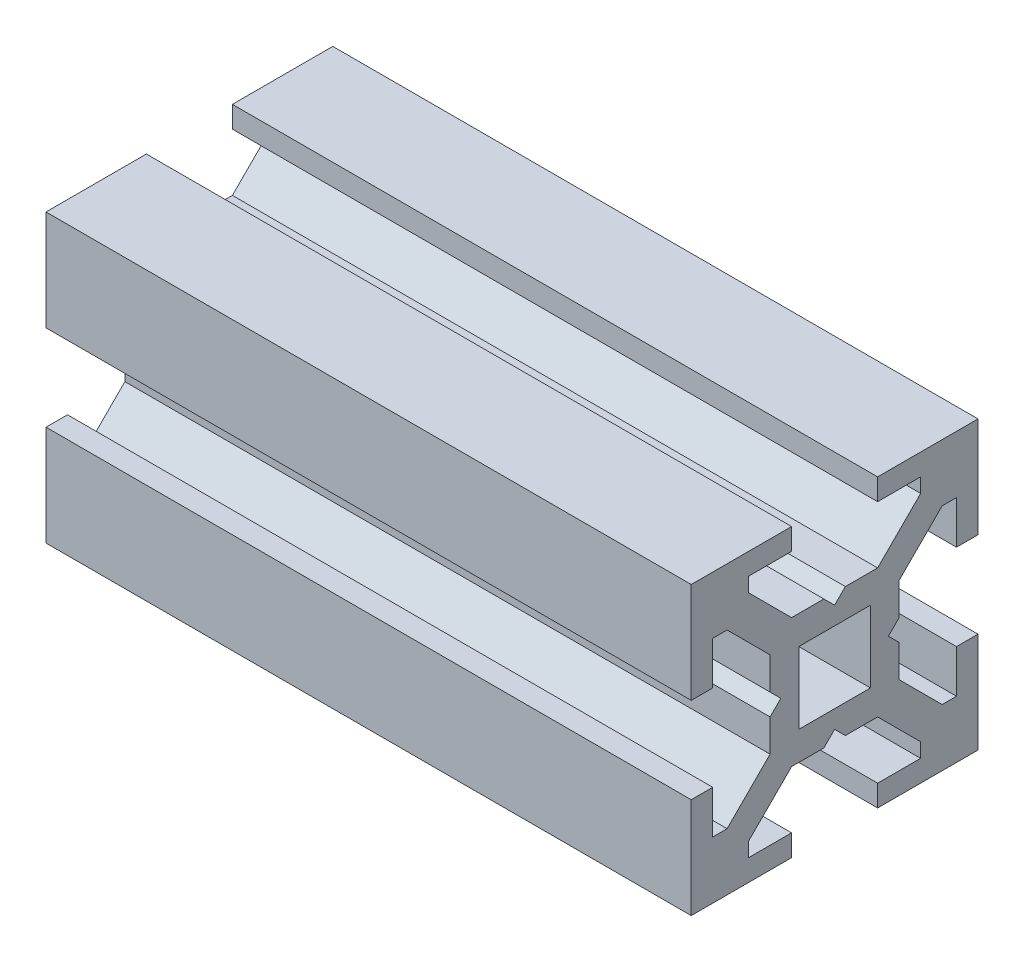
from build123d import *

# Parameters (mm, degrees)
SKETCH1_W           = 5
SKETCH1_H           = 5
BOSS_EXTRUDE2_DEPTH = 45


with BuildPart() as part:
    # Sketch1 → Boss-Extrude2 (new body)
    with BuildSketch(Plane(origin=(0, 0, 0), x_dir=(0, 0, -1), z_dir=(1, 0, 0))):
        Polygon((-10, 10), (-3, 10), (-3, 8.5), (-6, 8.5), (-6, 7.5), (-3, 4.5), (-0.75, 4.5), (0, 3.75), (0.75, 4.5), (3, 4.5), (6, 7.5), (6, 8.5), (3, 8.5), (3, 10), (10, 10), (10, 3), (8.5, 3), (8.5, 6), (7.5, 6), (4.5, 3), (4.5, 0.75), (3.75, 0), (4.5, -0.75), (4.5, -3), (7.5, -6), (8.5, -6), (8.5, -3), (10, -3), (10, -10), (3, -10), (3, -8.5), (6, -8.5), (6, -7.5), (3, -4.5), (0.75, -4.5), (0, -3.75), (-0.75, -4.5), (-3, -4.5), (-6, -7.5), (-6, -8.5), (-3, -8.5), (-3, -10), (-10, -10), (-10, -3), (-8.5, -3), (-8.5, -6), (-7.5, -6), (-4.5, -3), (-4.5, -0.75), (-3.75, 0), (-4.5, 0.75), (-4.5, 3), (-7.5, 6), (-8.5, 6), (-8.5, 3), (-10, 3), align=None)
        Rectangle(SKETCH1_W, SKETCH1_H, mode=Mode.SUBTRACT)
    extrude(amount=BOSS_EXTRUDE2_DEPTH)


solid = part.part
